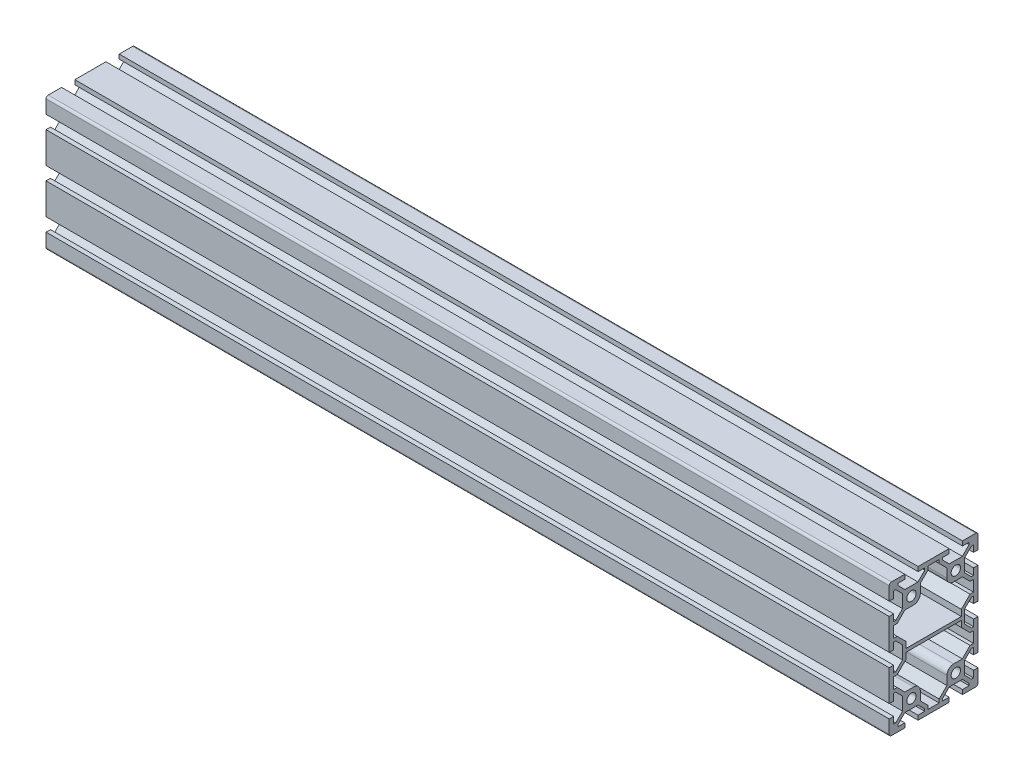
from build123d import *

# Parameters (mm, degrees)
SKETCH1_R           = 2.1
BOSS_EXTRUDE1_DEPTH = 380


with BuildPart() as part:
    # Sketch1 → Boss-Extrude1 (new body)
    with BuildSketch(Plane(origin=(0, 0, 0), x_dir=(0, 0, -1), z_dir=(1, 0, 0))):
        with BuildLine():
            Line((-20, 29), (-20, 23))
            Line((-20, 23), (-18, 23))
            Line((-18, 23), (-18, 26))
            Line((-18, 26), (-17.060660172, 26))
            Line((-17.060660172, 26), (-14, 22.939339828))
            Line((-14, 22.939339828), (-14, 17.060660172))
            Line((-14, 17.060660172), (-17.060660172, 14))
            Line((-17.060660172, 14), (-18, 14))
            Line((-18, 14), (-18, 17))
            Line((-18, 17), (-20, 17))
            Line((-20, 17), (-20, 3))
            Line((-20, 3), (-18, 3))
            Line((-18, 3), (-18, 6))
            Line((-18, 6), (-17.060660172, 6))
            Line((-17.060660172, 6), (-14, 2.939339828))
            Line((-14, 2.939339828), (-14, -2.939339828))
            Line((-14, -2.939339828), (-17.060660172, -6))
            Line((-17.060660172, -6), (-18, -6))
            Line((-18, -6), (-18, -3))
            Line((-18, -3), (-20, -3))
            Line((-20, -3), (-20, -17))
            Line((-20, -17), (-18, -17))
            Line((-18, -17), (-18, -14))
            Line((-18, -14), (-17.060660172, -14))
            Line((-17.060660172, -14), (-14, -17.060660172))
            Line((-14, -17.060660172), (-14, -22.939339828))
            Line((-14, -22.939339828), (-17.060660172, -26))
            Line((-17.060660172, -26), (-18, -26))
            Line((-18, -26), (-18, -23))
            Line((-18, -23), (-20, -23))
            Line((-20, -23), (-20, -29))
            ThreePointArc((-20, -29), (-19.707106781, -29.707106781), (-19, -30))
            Line((-19, -30), (-13, -30))
            Line((-13, -30), (-13, -28))
            Line((-13, -28), (-16, -28))
            Line((-16, -28), (-16, -27.060660172))
            Line((-16, -27.060660172), (-12.939339828, -24))
            Line((-12.939339828, -24), (-7.060660172, -24))
            Line((-7.060660172, -24), (-4, -27.060660172))
            Line((-4, -27.060660172), (-4, -28))
            Line((-4, -28), (-7, -28))
            Line((-7, -28), (-7, -30))
            Line((-7, -30), (7, -30))
            Line((7, -30), (7, -28))
            Line((7, -28), (4, -28))
            Line((4, -28), (4, -27.060660172))
            Line((4, -27.060660172), (7.060660172, -24))
            Line((7.060660172, -24), (12.939339828, -24))
            Line((12.939339828, -24), (16, -27.060660172))
            Line((16, -27.060660172), (16, -28))
            Line((16, -28), (13, -28))
            Line((13, -28), (13, -30))
            Line((13, -30), (19, -30))
            ThreePointArc((19, -30), (19.707106781, -29.707106781), (20, -29))
            Line((20, -29), (20, -23))
            Line((20, -23), (18, -23))
            Line((18, -23), (18, -26))
            Line((18, -26), (17.060660172, -26))
            Line((17.060660172, -26), (14, -22.939339828))
            Line((14, -22.939339828), (14, -17.060660172))
            Line((14, -17.060660172), (17.060660172, -14))
            Line((17.060660172, -14), (18, -14))
            Line((18, -14), (18, -17))
            Line((18, -17), (20, -17))
            Line((20, -17), (20, -3))
            Line((20, -3), (18, -3))
            Line((18, -3), (18, -6))
            Line((18, -6), (17.060660172, -6))
            Line((17.060660172, -6), (14, -2.939339828))
            Line((14, -2.939339828), (14, 2.939339828))
            Line((14, 2.939339828), (17.060660172, 6))
            Line((17.060660172, 6), (18, 6))
            Line((18, 6), (18, 3))
            Line((18, 3), (20, 3))
            Line((20, 3), (20, 17))
            Line((20, 17), (18, 17))
            Line((18, 17), (18, 14))
            Line((18, 14), (17.060660172, 14))
            Line((17.060660172, 14), (14, 17.060660172))
            Line((14, 17.060660172), (14, 22.939339828))
            Line((14, 22.939339828), (17.060660172, 26))
            Line((17.060660172, 26), (18, 26))
            Line((18, 26), (18, 23))
            Line((18, 23), (20, 23))
            Line((20, 23), (20, 29))
            ThreePointArc((20, 29), (19.707106781, 29.707106781), (19, 30))
            Line((19, 30), (13, 30))
            Line((13, 30), (13, 28))
            Line((13, 28), (16, 28))
            Line((16, 28), (16, 27.060660172))
            Line((16, 27.060660172), (12.939339828, 24))
            Line((12.939339828, 24), (7.060660172, 24))
            Line((7.060660172, 24), (4, 27.060660172))
            Line((4, 27.060660172), (4, 28))
            Line((4, 28), (7, 28))
            Line((7, 28), (7, 30))
            Line((7, 30), (-7, 30))
            Line((-7, 30), (-7, 28))
            Line((-7, 28), (-4, 28))
            Line((-4, 28), (-4, 27.060660172))
            Line((-4, 27.060660172), (-7.060660172, 24))
            Line((-7.060660172, 24), (-12.939339828, 24))
            Line((-12.939339828, 24), (-16, 27.060660172))
            Line((-16, 27.060660172), (-16, 28))
            Line((-16, 28), (-13, 28))
            Line((-13, 28), (-13, 30))
            Line((-13, 30), (-19, 30))
            ThreePointArc((-19, 30), (-19.707106781, 29.707106781), (-20, 29))
        make_face()
        with Locations((-10, 20)):
            Circle(SKETCH1_R, mode=Mode.SUBTRACT)
        with Locations((10, 20)):
            Circle(SKETCH1_R, mode=Mode.SUBTRACT)
        with Locations((10, -20)):
            Circle(SKETCH1_R, mode=Mode.SUBTRACT)
        with Locations((-10, -20)):
            Circle(SKETCH1_R, mode=Mode.SUBTRACT)
        with BuildLine():
            Line((-16.439339828, 12.5), (-18, 12.5))
            Line((-18, 12.5), (-18, 7.5))
            Line((-18, 7.5), (-16.439339828, 7.5))
            Line((-16.439339828, 7.5), (-12.5, 3.560660172))
            Line((-12.5, 3.560660172), (-12.5, 0.75))
            Line((-12.5, 0.75), (12.5, 0.75))
            Line((12.5, 0.75), (12.5, 3.560660172))
            Line((12.5, 3.560660172), (16.439339828, 7.5))
            Line((16.439339828, 7.5), (18, 7.5))
            Line((18, 7.5), (18, 12.5))
            Line((18, 12.5), (16.439339828, 12.5))
            Line((16.439339828, 12.5), (12.939339828, 16))
            Line((12.939339828, 16), (9, 16))
            ThreePointArc((9, 16), (6.878679656, 16.878679656), (6, 19))
            Line((6, 19), (6, 22.939339828))
            Line((6, 22.939339828), (2.5, 26.439339828))
            Line((2.5, 26.439339828), (2.5, 28))
            Line((2.5, 28), (-2.5, 28))
            Line((-2.5, 28), (-2.5, 26.439339828))
            Line((-2.5, 26.439339828), (-6, 22.939339828))
            Line((-6, 22.939339828), (-6, 19))
            ThreePointArc((-6, 19), (-6.878679656, 16.878679656), (-9, 16))
            Line((-9, 16), (-12.939339828, 16))
            Line((-12.939339828, 16), (-16.439339828, 12.5))
        make_face(mode=Mode.SUBTRACT)
        with BuildLine():
            Line((-18, -7.5), (-18, -12.5))
            Line((-18, -12.5), (-16.439339828, -12.5))
            Line((-16.439339828, -12.5), (-12.939339828, -16))
            Line((-12.939339828, -16), (-9, -16))
            ThreePointArc((-9, -16), (-6.878679656, -16.878679656), (-6, -19))
            Line((-6, -19), (-6, -22.939339828))
            Line((-6, -22.939339828), (-2.5, -26.439339828))
            Line((-2.5, -26.439339828), (-2.5, -28))
            Line((-2.5, -28), (2.5, -28))
            Line((2.5, -28), (2.5, -26.439339828))
            Line((2.5, -26.439339828), (6, -22.939339828))
            Line((6, -22.939339828), (6, -19))
            ThreePointArc((6, -19), (6.878679656, -16.878679656), (9, -16))
            Line((9, -16), (12.939339828, -16))
            Line((12.939339828, -16), (16.439339828, -12.5))
            Line((16.439339828, -12.5), (18, -12.5))
            Line((18, -12.5), (18, -7.5))
            Line((18, -7.5), (16.439339828, -7.5))
            Line((16.439339828, -7.5), (12.5, -3.560660172))
            Line((12.5, -3.560660172), (12.5, -0.75))
            Line((12.5, -0.75), (-12.5, -0.75))
            Line((-12.5, -0.75), (-12.5, -3.560660172))
            Line((-12.5, -3.560660172), (-16.439339828, -7.5))
            Line((-16.439339828, -7.5), (-18, -7.5))
        make_face(mode=Mode.SUBTRACT)
    extrude(amount=BOSS_EXTRUDE1_DEPTH)


solid = part.part
